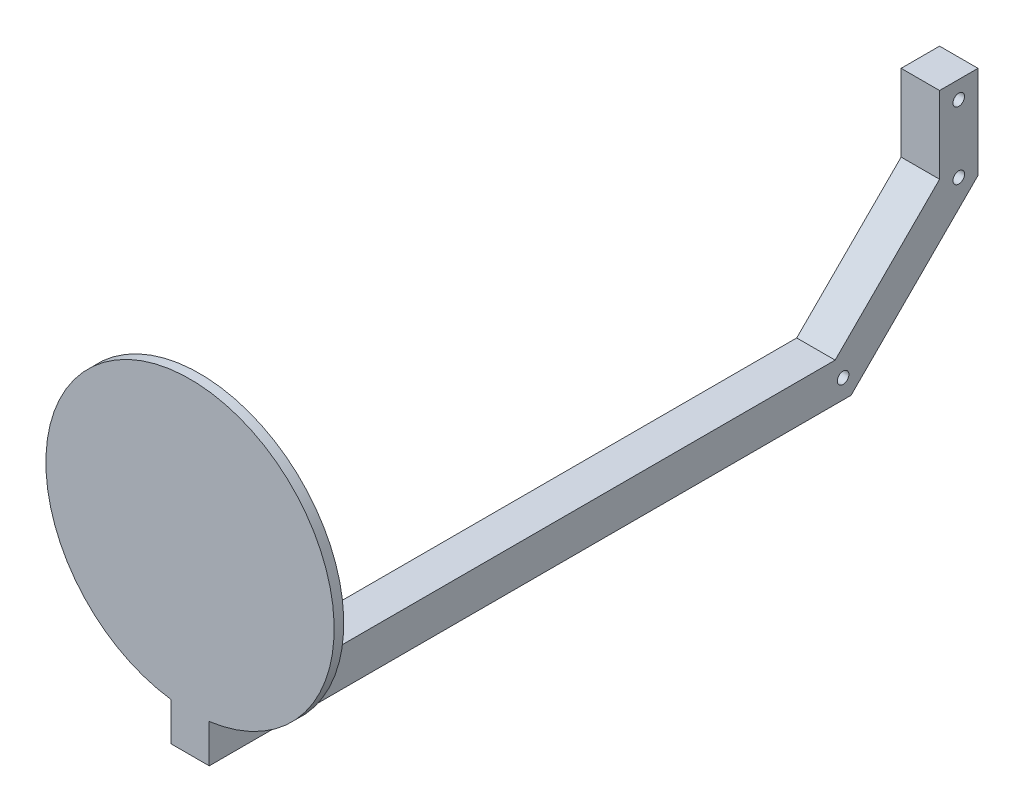
from build123d import *

# Parameters (mm, degrees)
BOSS_EXTRU_1_DEPTH      = 5
BOSS_EXTRU_3_DEPTH      = 20
ESQUISSE7_R             = 3
ENL_V_MAT_EXTRU_1_DEPTH = 20


with BuildPart() as part:
    # Esquisse1 → Boss.-Extru.1 (new body)
    with BuildSketch(Plane.XY):
        with BuildLine():
            Line((-10, -74.330343737), (-10, -94.330343737))
            Line((-10, -94.330343737), (10, -94.330343737))
            Line((10, -94.330343737), (10, -74.330343737))
            ThreePointArc((10, -74.330343737), (0, 75), (-10, -74.330343737))
        make_face()
    extrude(amount=BOSS_EXTRU_1_DEPTH)

    # Esquisse6 → Boss.-Extru.3 (add)
    with BuildSketch(Plane(origin=(10, 0, 0), x_dir=(0, 0, -1), z_dir=(1, 0, 0))):
        Polygon((375, -20), (320.669656263, -74.330343737), (-5, -74.330343737), (-5, -94.330343737), (328.953927511, -94.330343737), (395, -28.284271247), (395, 20), (375, 20), align=None)
    extrude(amount=-BOSS_EXTRU_3_DEPTH)

    # Esquisse7 → Enlèv. mat.-Extru.1 (cut)
    with BuildSketch(Plane(origin=(10, 0, 0), x_dir=(0, 0, -1), z_dir=(1, 0, 0))):
        with Locations(Location((324.811791887, -84.330343737, 0), (0, 0, 90))):
            Circle(ESQUISSE7_R)
        with Locations(Location((385, -24.142135624, 0), (0, 0, 90))):
            Circle(ESQUISSE7_R)
        with Locations(Location((385, 10.857864376, 0), (0, 0, 90))):
            Circle(ESQUISSE7_R)
        with Locations(Location((25, -84.330343737, 0), (0, 0, 90))):
            Circle(ESQUISSE7_R)
    extrude(amount=-ENL_V_MAT_EXTRU_1_DEPTH, mode=Mode.SUBTRACT)


solid = part.part
